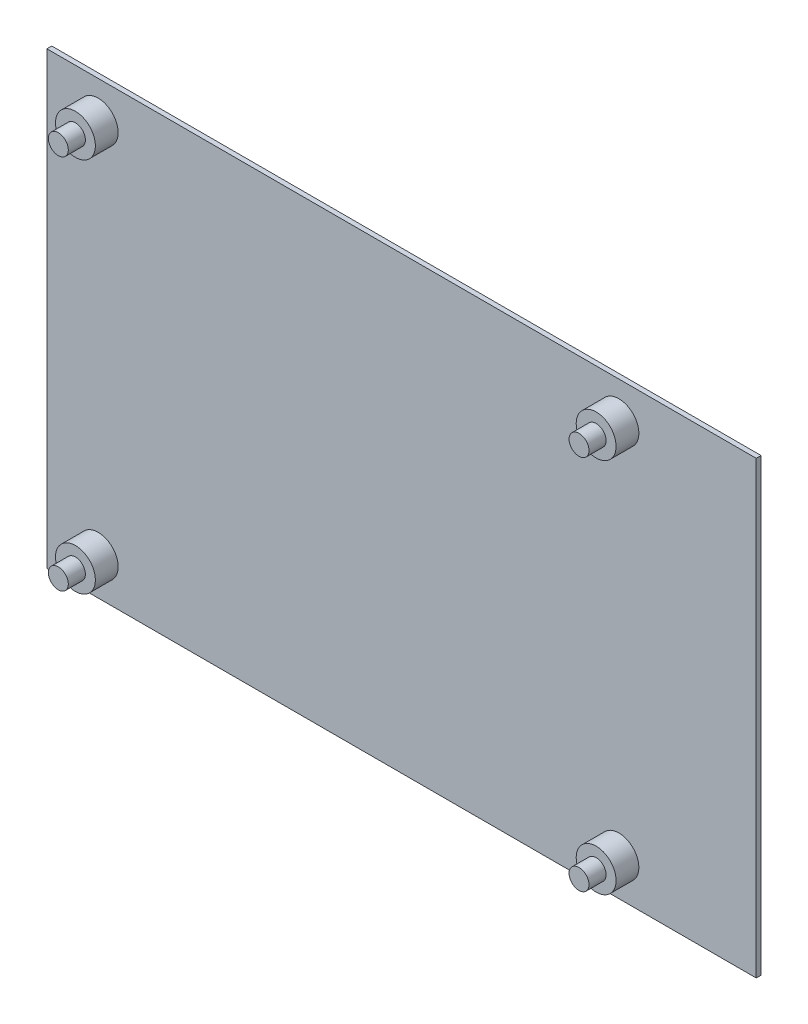
from build123d import *

# Parameters (mm, degrees)
SKETCH1_W           = 124.5
SKETCH1_H           = 79
BOSS_EXTRUDE1_DEPTH = 0.85
SKETCH2_R           = 3.5
BOSS_EXTRUDE2_DEPTH = 4
SKETCH3_R           = 1.75
BOSS_EXTRUDE3_DEPTH = 3


with BuildPart() as part:
    # Sketch1 → Boss-Extrude1 (new body)
    with BuildSketch(Plane.XY):
        with Locations((-15, -16.8)):
            Rectangle(SKETCH1_W, SKETCH1_H)
    extrude(amount=BOSS_EXTRUDE1_DEPTH)

    # Sketch2 → Boss-Extrude2 (add)
    with BuildSketch(Plane.XY.offset(0.85)):
        with Locations(Location((-68.25, 16.2, 0), (0, 0, 180))):
            Circle(SKETCH2_R)
        with Locations(Location((23.15, 16.2, 0), (0, 0, 180))):
            Circle(SKETCH2_R)
        with Locations(Location((23.15, -49.8, 0), (0, 0, 180))):
            Circle(SKETCH2_R)
        with Locations(Location((-68.25, -49.8, 0), (0, 0, 180))):
            Circle(SKETCH2_R)
    extrude(amount=BOSS_EXTRUDE2_DEPTH)

    # Sketch3 → Boss-Extrude3 (add)
    with BuildSketch(Plane.XY.offset(4.85)):
        with Locations((-68.25, 16.2)):
            Circle(SKETCH3_R)
        with Locations((23.15, 16.2)):
            Circle(SKETCH3_R)
        with Locations((23.15, -49.8)):
            Circle(SKETCH3_R)
        with Locations((-68.25, -49.8)):
            Circle(SKETCH3_R)
    extrude(amount=BOSS_EXTRUDE3_DEPTH)


solid = part.part
